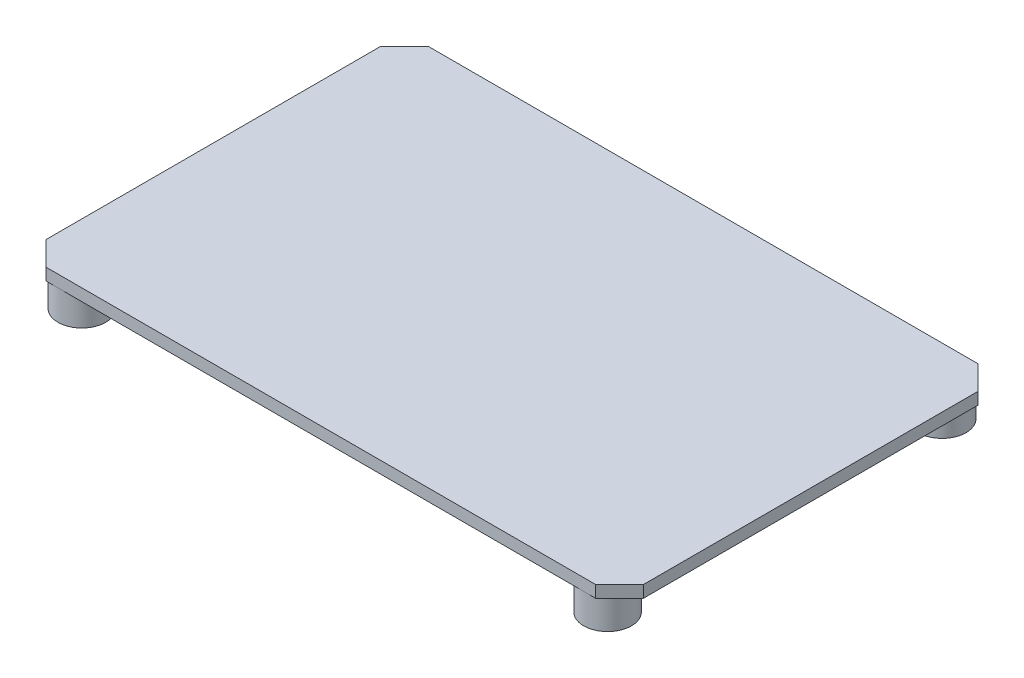
from build123d import *

# Parameters (mm, degrees)
SHADE_PLATE_DEPTH = 2
SKETCH2_R         = 4
POSTS_DEPTH       = 5.1
SKETCH3_R         = 1.25
POST_PILOTS_DEPTH = 6.5


with BuildPart() as part:
    # Sketch1 → Shade Plate (new body)
    with BuildSketch(Plane(origin=(0, 17.4, 0), x_dir=(1, 0, 0), z_dir=(0, 1, 0))):
        Polygon((-46, -84), (46, -84), (50, -80), (50, -24), (46, -20), (-46, -20), (-50, -24), (-50, -80), align=None)
    extrude(amount=SHADE_PLATE_DEPTH)

    # Sketch2 → Posts (add)
    with BuildSketch(Plane(origin=(0, 12.4, 0), x_dir=(1, 0, 0), z_dir=(0, 1, 0))):
        with Locations(Location((-44, -24, 0), (0, 0, 90))):
            Circle(SKETCH2_R)
        with Locations(Location((-44, -80, 0), (0, 0, 270))):
            Circle(SKETCH2_R)
        with Locations(Location((44, -24, 0), (0, 0, 90))):
            Circle(SKETCH2_R)
        with Locations(Location((44, -80, 0), (0, 0, 270))):
            Circle(SKETCH2_R)
    extrude(amount=POSTS_DEPTH)

    # Sketch3 → Post Pilots (cut)
    with BuildSketch(Plane(origin=(0, 11.9, 0), x_dir=(1, 0, 0), z_dir=(0, 1, 0))):
        with Locations(Location((-44, -24, 0), (0, 0, 270))):
            Circle(SKETCH3_R)
        with Locations(Location((-44, -80, 0), (0, 0, 270))):
            Circle(SKETCH3_R)
        with Locations(Location((44, -24, 0), (0, 0, 270))):
            Circle(SKETCH3_R)
        with Locations(Location((44, -80, 0), (0, 0, 270))):
            Circle(SKETCH3_R)
    extrude(amount=POST_PILOTS_DEPTH, mode=Mode.SUBTRACT)


solid = part.part
